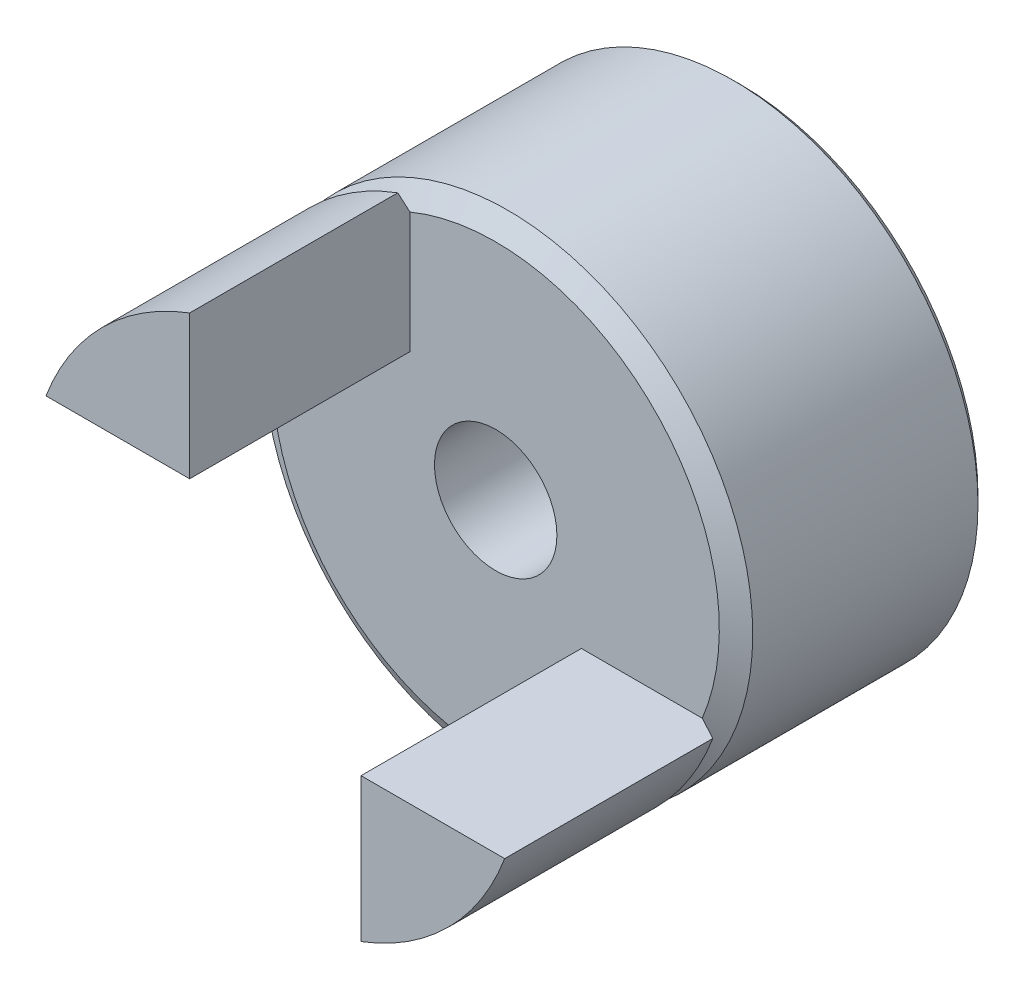
from build123d import *

# Parameters (mm, degrees)
SKETCH_1_R      = 10
SKETCH_1_R_2    = 2.5
EXTRUDE_1_DEPTH = 10
CHAMFER_1_SIZE  = 0.3
EXTRUDE_2_DEPTH = 9


with BuildPart() as part:
    # 스케치1 → 보스-돌출1 (new body)
    with BuildSketch(Plane.XY):
        Circle(SKETCH_1_R)
        Circle(SKETCH_1_R_2, mode=Mode.SUBTRACT)
    extrude(amount=EXTRUDE_1_DEPTH)

    # 모따기1
    chamfer_1_edges = [part.edges().sort_by_distance(p)[0] for p in [
        (-10, 0, 0),
        (-2.5, 0, 0),
    ]]
    chamfer(chamfer_1_edges, length=CHAMFER_1_SIZE)

    # 스케치2 → 보스-돌출2 (add)
    with BuildSketch(Plane.XY.offset(10)):
        with BuildLine():
            ThreePointArc((-3.5, 9.367496998), (-7.071067812, 7.071067812), (-9.367496998, 3.5))
            Line((-9.367496998, 3.5), (-3.5, 3.5))
            Line((-3.5, 3.5), (-3.5, 9.367496998))
        make_face()
        with BuildLine():
            Line((9.367496998, -3.5), (3.5, -3.5))
            Line((3.5, -3.5), (3.5, -9.367496998))
            ThreePointArc((3.5, -9.367496998), (7.071067812, -7.071067812), (9.367496998, -3.5))
        make_face()
    extrude(amount=EXTRUDE_2_DEPTH)

    # 스케치3 → 컷-회전1 (revolve, cut)
    with BuildSketch(Plane(origin=(0, 0, 0), x_dir=(1, 0, 0), z_dir=(0, 1, 0)), mode=Mode.PRIVATE) as cut_revolve_1_sk:
        Polygon((9.133974596, -10), (10, -10.5), (10, -9.5), align=None)
    revolve(cut_revolve_1_sk.sketch.rotate(Axis((0, 0, 0), (0, 0, 1)), 180), axis=Axis((0, 0, 0), (0, 0, 1)), mode=Mode.SUBTRACT)


solid = part.part
